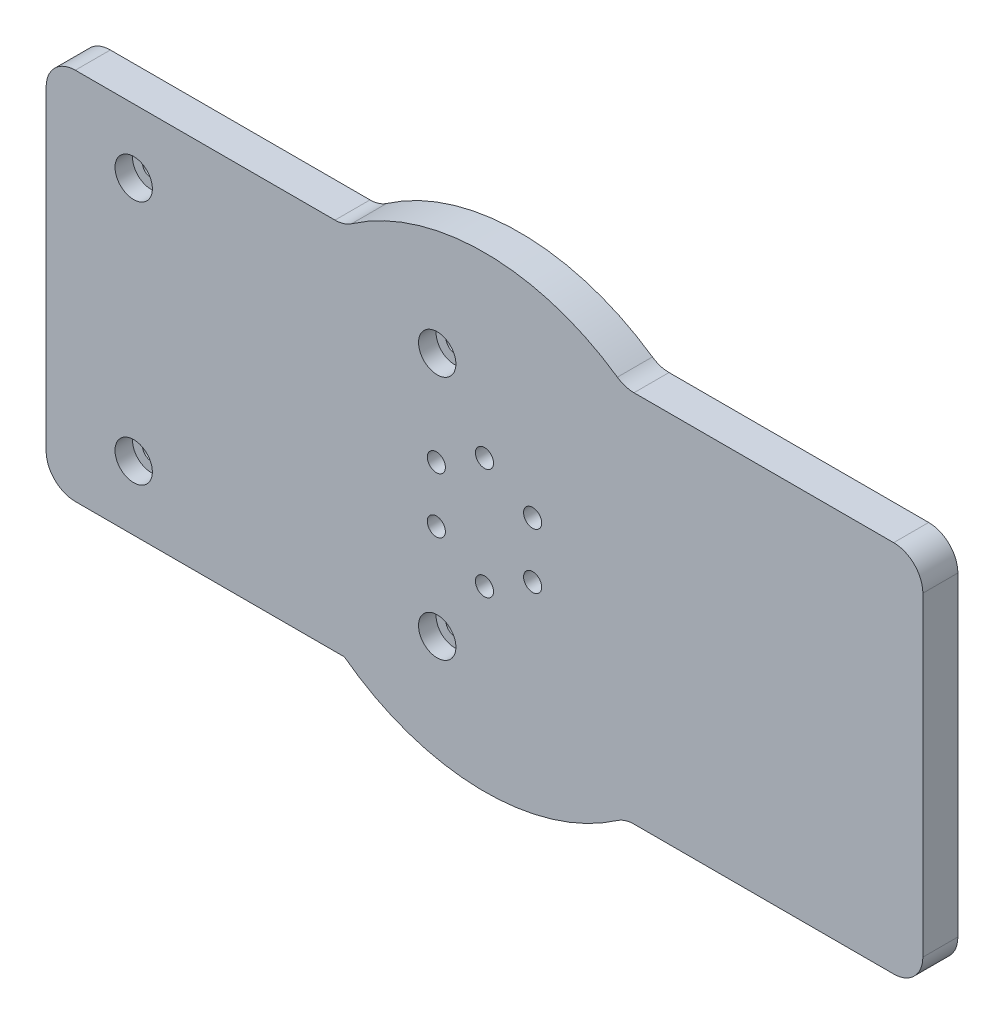
from build123d import *

# Parameters (mm, degrees)
SKETCH1_W                = 150.2
SKETCH1_H                = 64
BOSS_EXTRUDE1_DEPTH      = 6
FILLET1_R                = 5
BOSS_EXTRUDE2_DEPTH      = 40
BOSS_EXTRUDE2_DEPTH_BACK = 10
SKETCH2_W                = 60
SKETCH2_H                = 6
FILLET2_R                = 5
SKETCH3_R                = 40
BOSS_EXTRUDE4_DEPTH      = 6
FILLET4_R                = 5
SKETCH4_R                = 1.55
CUT_EXTRUDE1_DEPTH       = 167.673453195
CUT_EXTRUDE2_START       = -10
CUT_EXTRUDE2_DEPTH       = 10
FILLET5_R                = 5
SKETCH6_R                = 1.5
CUT_EXTRUDE3_DEPTH       = 167.673453195
SKETCH7_R                = 1.5
CUT_EXTRUDE4_DEPTH       = 167.673453195
SKETCH9_R                = 3.2
CUT_EXTRUDE5_DEPTH       = 3


with BuildPart() as part:
    # Sketch1 → Boss-Extrude1 (new body)
    with BuildSketch(Plane.XY):
        with Locations((75.1, 32)):
            Rectangle(SKETCH1_W, SKETCH1_H)
    extrude(amount=BOSS_EXTRUDE1_DEPTH)

    # Fillet1
    fillet1_edges = [part.edges().sort_by_distance(p)[0] for p in [
        (0, 64, 3),
        (150.2, 64, 3),
        (150.2, 0, 3),
        (0, 0, 3),
    ]]
    fillet(fillet1_edges, radius=FILLET1_R)

    # Sketch2 → Boss-Extrude2 (add, two sides: drawn at the far end of the back side and taken through both)
    with BuildSketch(Plane.XZ.offset(-BOSS_EXTRUDE2_DEPTH_BACK)):
        with Locations((30, 3)):
            Rectangle(SKETCH2_W, SKETCH2_H)
    extrude(amount=BOSS_EXTRUDE2_DEPTH + BOSS_EXTRUDE2_DEPTH_BACK)

    # Fillet2
    fillet2_edges = [part.edges().sort_by_distance(p)[0] for p in [
        (0, -40, 3),
        (60, -40, 3),
    ]]
    fillet(fillet2_edges, radius=FILLET2_R)

    # Sketch3 → Boss-Extrude4 (add)
    with BuildSketch(Plane.XY.offset(6)):
        with Locations((75.1, 32)):
            Circle(SKETCH3_R)
    extrude(amount=-BOSS_EXTRUDE4_DEPTH)

    # Fillet4
    fillet4_edges = [part.edges().sort_by_distance(p)[0] for p in [
        (60, -5.040383367, 3),
        (99.1, 0, 3),
        (99.1, 64, 3),
        (51.1, 64, 3),
    ]]
    fillet(fillet4_edges, radius=FILLET4_R)

    # Sketch4 → Cut-Extrude1 (cut, through all)
    with BuildSketch(Plane.XY.offset(6)):
        with Locations((75.1, 41.525)):
            Circle(SKETCH4_R)
        with Locations((83.348891971, 36.7625)):
            Circle(SKETCH4_R)
        with Locations((83.348891971, 27.2375)):
            Circle(SKETCH4_R)
        with Locations((75.1, 22.475)):
            Circle(SKETCH4_R)
        with Locations((66.851108029, 27.2375)):
            Circle(SKETCH4_R)
        with Locations((66.851108029, 36.7625)):
            Circle(SKETCH4_R)
    extrude(amount=-CUT_EXTRUDE1_DEPTH, mode=Mode.SUBTRACT)

    # Sketch5 → Cut-Extrude2 (cut)
    with BuildSketch(Plane(origin=(0, 0, 0), x_dir=(-1, 0, 0), z_dir=(0, 0, -1)).offset(CUT_EXTRUDE2_START)):
        with BuildLine():
            Line((0, 0), (-51.1, 0))
            ThreePointArc((-51.1, 0), (-58.245869166, -4.275863516), (-66.122222222, -6.979475448))
            ThreePointArc((-66.122222222, -6.979475448), (-61.886409718, -7.939678347), (-60, -11.851909879))
            Line((-60, -11.851909879), (-60, -35))
            ThreePointArc((-60, -35), (-58.535533906, -38.535533906), (-55, -40))
            Line((-55, -40), (-5, -40))
            ThreePointArc((-5, -40), (-1.464466094, -38.535533906), (0, -35))
            Line((0, -35), (0, 0))
        make_face()
    extrude(amount=CUT_EXTRUDE2_DEPTH, mode=Mode.SUBTRACT)

    # Fillet5
    fillet5_edges = [part.edges().sort_by_distance(p)[0] for p in [
        (0, 0, 3),
    ]]
    fillet(fillet5_edges, radius=FILLET5_R)

    # Sketch6 → Cut-Extrude3 (cut, through all)
    with BuildSketch(Plane.XY.offset(6)):
        with Locations((15, 11)):
            Circle(SKETCH6_R)
        with Locations((15, 53)):
            Circle(SKETCH6_R)
    extrude(amount=-CUT_EXTRUDE3_DEPTH, mode=Mode.SUBTRACT)

    # Sketch7 → Cut-Extrude4 (cut, through all)
    with BuildSketch(Plane.XY.offset(6)):
        with Locations((67, 53)):
            Circle(SKETCH7_R)
        with Locations((67, 11)):
            Circle(SKETCH7_R)
    extrude(amount=-CUT_EXTRUDE4_DEPTH, mode=Mode.SUBTRACT)

    # Sketch9 → Cut-Extrude5 (cut)
    with BuildSketch(Plane.XY.offset(6)):
        with Locations((15, 53)):
            Circle(SKETCH9_R)
        with Locations((67, 53)):
            Circle(SKETCH9_R)
        with Locations((15, 11)):
            Circle(SKETCH9_R)
        with Locations((67, 11)):
            Circle(SKETCH9_R)
    extrude(amount=-CUT_EXTRUDE5_DEPTH, mode=Mode.SUBTRACT)


solid = part.part
